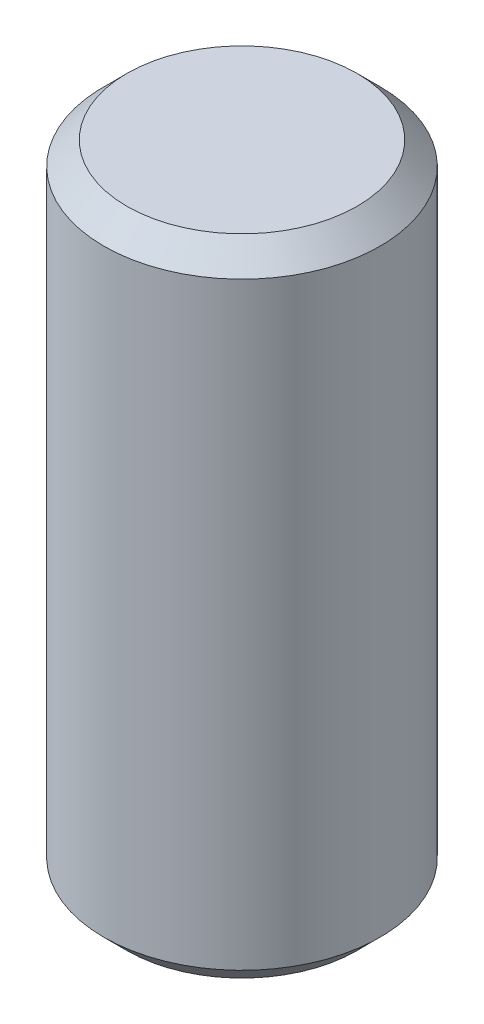
from build123d import *


with BuildPart() as part:
    # Sketch24 → Revolve2 (revolve)
    with BuildSketch(Plane(origin=(0, 0, 0), x_dir=(0, 0, -1), z_dir=(1, 0, 0))):
        Polygon((-1.25, -3.175), (-1.5, -2.925), (-1.5, 3.575), (-1.25, 3.825), (0, 3.825), (0, -2.508333333), (-1, -2.508333333), (-1, -3.175), align=None)
    revolve(axis=Axis((0, 3.825, 0), (0, -1, 0)))


with BuildPart() as body_2:
    # Sketch25 → Revolve3 (revolve)
    with BuildSketch(Plane(origin=(0, 0, 0), x_dir=(0, 0, -1), z_dir=(1, 0, 0))):
        with BuildLine():
            Line((0, -3.825), (0, -1.825))
            ThreePointArc((0, -1.825), (-1, -2.825), (0, -3.825))
        make_face()
    revolve(axis=Axis((0, -2.508333333, 0), (0, 1, 0)))


solid = Compound([part.part, body_2.part])
